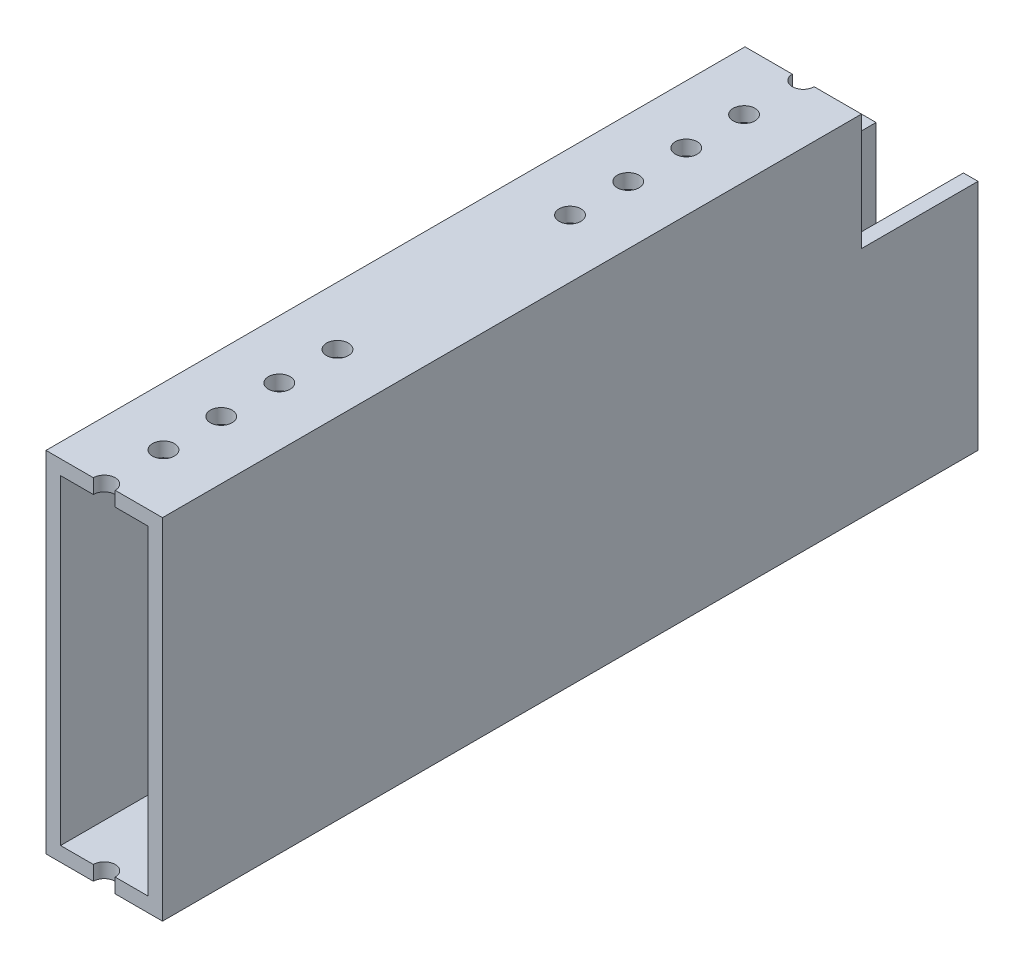
from build123d import *

# Parameters (mm, degrees)
SKETCH1_W           = 25.4
SKETCH1_H           = 76.2
BOSS_EXTRUDE1_DEPTH = 88.9
SHELL1_T            = -3.175
SKETCH2_W           = 25.4
SKETCH2_H           = 25.4
CUT_EXTRUDE1_DEPTH  = 100.9999
SKETCH3_R           = 2.38125
CUT_EXTRUDE2_DEPTH  = 118.774954893


with BuildPart() as part:
    # Sketch1 → Boss-Extrude1 (new, symmetric)
    with BuildSketch(Plane.XY):
        Rectangle(SKETCH1_W, SKETCH1_H)
    extrude(amount=BOSS_EXTRUDE1_DEPTH, both=True)

    # Shell1
    shell1_openings = [part.faces().sort_by_distance(p)[0] for p in [
        (0, 0, 88.9),
        (0, 0, -88.9),
    ]]
    offset(amount=SHELL1_T, openings=shell1_openings, kind=Kind.INTERSECTION)

    # Sketch2 → Cut-Extrude1 (cut, through all)
    with BuildSketch(Plane.ZY.offset(12.7)):
        with Locations((-76.2, 25.4)):
            Rectangle(SKETCH2_W, SKETCH2_H)
    extrude(amount=-CUT_EXTRUDE1_DEPTH, mode=Mode.SUBTRACT)

    # Sketch3 → Cut-Extrude2 (cut, through all)
    with BuildSketch(Plane(origin=(0, 38.1, 0), x_dir=(1, 0, 0), z_dir=(0, 1, 0))):
        with Locations((0, -88.9)):
            Circle(SKETCH3_R)
        with Locations(Location((0, -75.995900078, 0), (0, 0, 270))):
            Circle(SKETCH3_R)
        with Locations(Location((0, -63.397337518, 0), (0, 0, 270))):
            Circle(SKETCH3_R)
        with Locations(Location((0, -50.731481722, 0), (0, 0, 270))):
            Circle(SKETCH3_R)
        with Locations(Location((0, -38.048590908, 0), (0, 0, 270))):
            Circle(SKETCH3_R)
        with Locations(Location((0, 63.5, 0), (0, 0, 270))):
            Circle(SKETCH3_R)
        with Locations(Location((0, 12.648590908, 0), (0, 0, 270))):
            Circle(SKETCH3_R)
        with Locations(Location((0, 25.331481722, 0), (0, 0, 270))):
            Circle(SKETCH3_R)
        with Locations(Location((0, 37.997337518, 0), (0, 0, 270))):
            Circle(SKETCH3_R)
        with Locations(Location((0, 50.595900078, 0), (0, 0, 270))):
            Circle(SKETCH3_R)
    extrude(amount=-CUT_EXTRUDE2_DEPTH, mode=Mode.SUBTRACT)


solid = part.part
